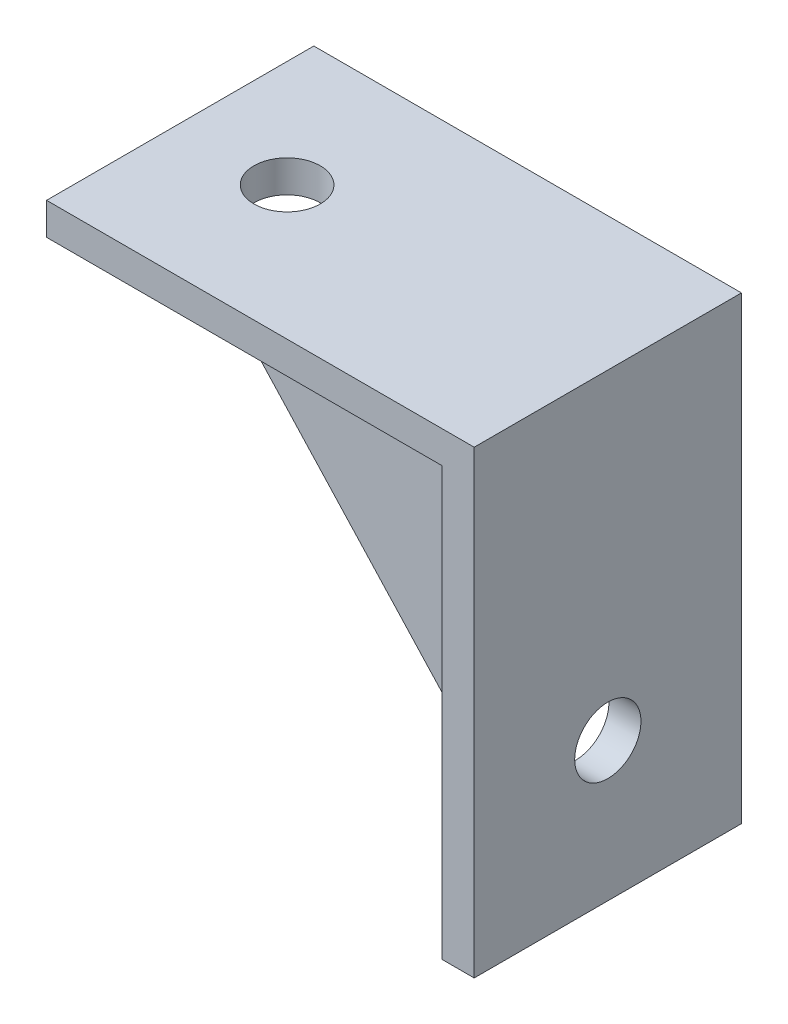
from build123d import *

# Parameters (mm, degrees)
SKETCH1_W           = 40
SKETCH1_H           = 25
SKETCH1_R           = 3.1
BOSS_EXTRUDE1_DEPTH = 3
SKETCH2_W           = 3
SKETCH2_H           = 25
BOSS_EXTRUDE2_DEPTH = 40
SKETCH3_R           = 3.1
CUT_EXTRUDE1_DEPTH  = 60.949979149
BOSS_EXTRUDE3_DEPTH = 10


with BuildPart() as part:
    # Sketch1 → Boss-Extrude1 (new body)
    with BuildSketch(Plane(origin=(0, 0, 0), x_dir=(1, 0, 0), z_dir=(0, 1, 0))):
        with Locations((20, -12.5)):
            Rectangle(SKETCH1_W, SKETCH1_H)
        with Locations(Location((10, -12.5, 0), (0, 0, 270))):
            Circle(SKETCH1_R, mode=Mode.SUBTRACT)
    extrude(amount=BOSS_EXTRUDE1_DEPTH)

    # Sketch2 → Boss-Extrude2 (add)
    with BuildSketch(Plane.XZ):
        with Locations((38.5, 12.5)):
            Rectangle(SKETCH2_W, SKETCH2_H)
    extrude(amount=BOSS_EXTRUDE2_DEPTH)

    # Sketch3 → Cut-Extrude1 (cut, through all)
    with BuildSketch(Plane.ZY.offset(-37)):
        with Locations((12.5, -27)):
            Circle(SKETCH3_R)
    extrude(amount=-CUT_EXTRUDE1_DEPTH, mode=Mode.SUBTRACT)

    # Sketch4 → Boss-Extrude3 (add, symmetric)
    with BuildSketch(Plane.XY.offset(12.5)):
        Polygon((15.275287554, 0), (37, -23.590932737), (37, 0), align=None)
    extrude(amount=BOSS_EXTRUDE3_DEPTH, both=True)


solid = part.part
